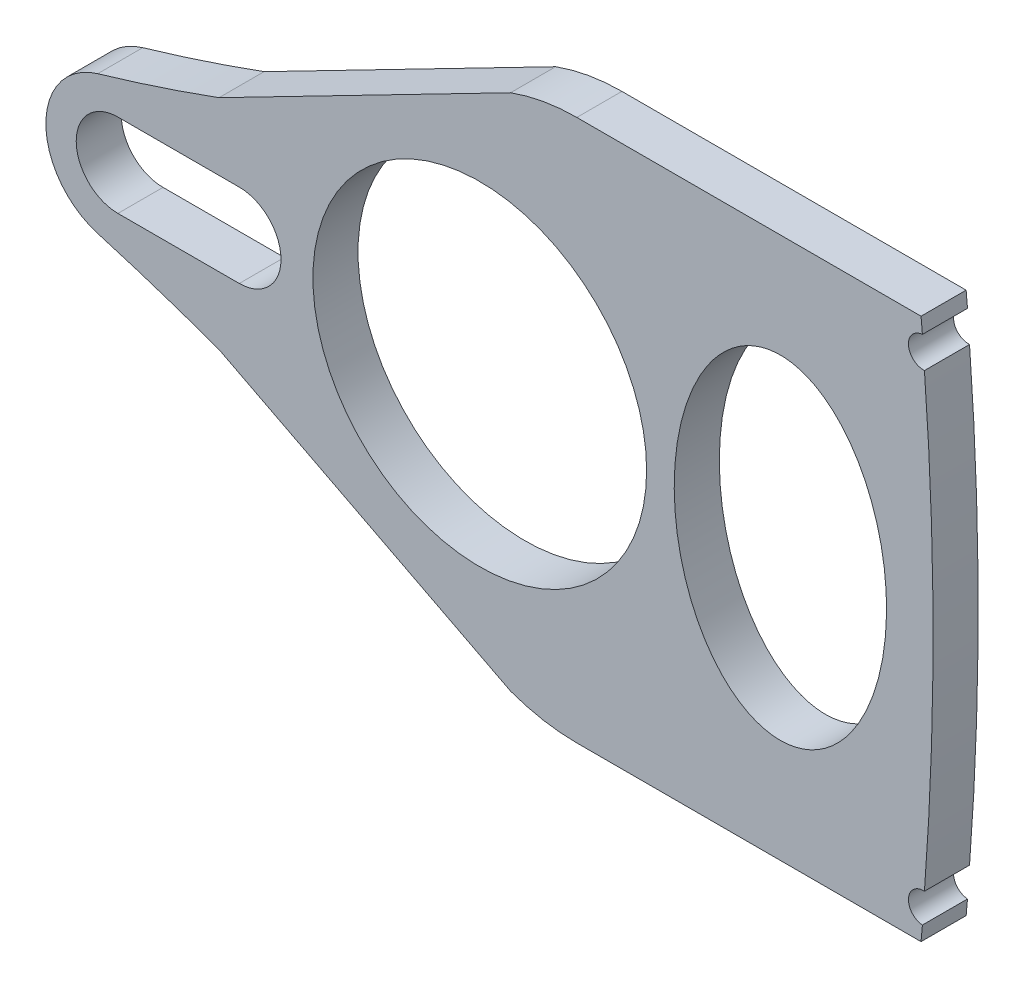
from build123d import *

# Parameters (mm, degrees)
SKETCH1_R           = 11.1010859
SKETCH1_RX          = 11.1010859
SKETCH1_RY          = 7.064327391
BOSS_EXTRUDE1_DEPTH = 3


with BuildPart() as part:
    # Sketch1 → Boss-Extrude1 (new body)
    with BuildSketch(Plane.XY):
        with BuildLine():
            Line((-7.947748781, 25.947914006), (-30.848746588, 25.949129975))
            ThreePointArc((-30.848746588, 25.949129975), (-33.08604518, 25.75234666), (-35.254642351, 25.168039404))
            Line((-35.254642351, 25.168039404), (-54.653402891, 15.184517643))
            ThreePointArc((-54.653402891, 15.184517643), (-58.666824966, 13.790309954), (-62.724252982, 12.529893468))
            ThreePointArc((-62.724252982, 12.529893468), (-66.171891815, 7.929095788), (-62.724252982, 3.328298109))
            ThreePointArc((-62.724252982, 3.328298109), (-58.666824966, 2.067881622), (-54.653402891, 0.673673934))
            Line((-54.653402891, 0.673673934), (-35.254642351, -9.309847827))
            ThreePointArc((-35.254642351, -9.309847827), (-33.08604518, -9.894155084), (-30.848746588, -10.090938398))
            Line((-30.848746588, -10.090938398), (-7.947748781, -10.08972243))
            ThreePointArc((-7.947748781, -10.08972243), (-7.901977934, -9.587204007), (-7.857501769, -9.084569342))
            ThreePointArc((-7.857501769, -9.084569342), (-8.447347212, -8.832838784), (-8.766415179, -8.276528123))
            ThreePointArc((-8.766415179, -8.276528123), (-8.539635898, -7.417867221), (-7.722112775, -7.070904212))
            ThreePointArc((-7.722112775, -7.070904212), (-7.146843313, 7.929095788), (-7.722112775, 22.929095788))
            ThreePointArc((-7.722112775, 22.929095788), (-8.539635898, 23.276058798), (-8.766415179, 24.134719699))
            ThreePointArc((-8.766415179, 24.134719699), (-8.447347212, 24.691030361), (-7.857501769, 24.942760918))
            ThreePointArc((-7.857501769, 24.942760918), (-7.901977934, 25.445395584), (-7.947748781, 25.947914006))
        make_face()
        with Locations((-37.304724068, 7.929095788)):
            Circle(SKETCH1_R, mode=Mode.SUBTRACT)
        with Locations(Location((-17.304724068, 7.929095788), (0, 0, -90))):
            Ellipse(SKETCH1_RX, SKETCH1_RY, mode=Mode.SUBTRACT)
        with BuildLine():
            Line((-61.378241086, 10.704367263), (-53.304724068, 10.704367263))
            ThreePointArc((-53.304724068, 10.704367263), (-50.529452593, 7.929095788), (-53.304724068, 5.153824313))
            Line((-53.304724068, 5.153824313), (-61.378241086, 5.153824313))
            ThreePointArc((-61.378241086, 5.153824313), (-64.153512561, 7.929095788), (-61.378241086, 10.704367263))
        make_face(mode=Mode.SUBTRACT)
    extrude(amount=BOSS_EXTRUDE1_DEPTH)


solid = part.part
